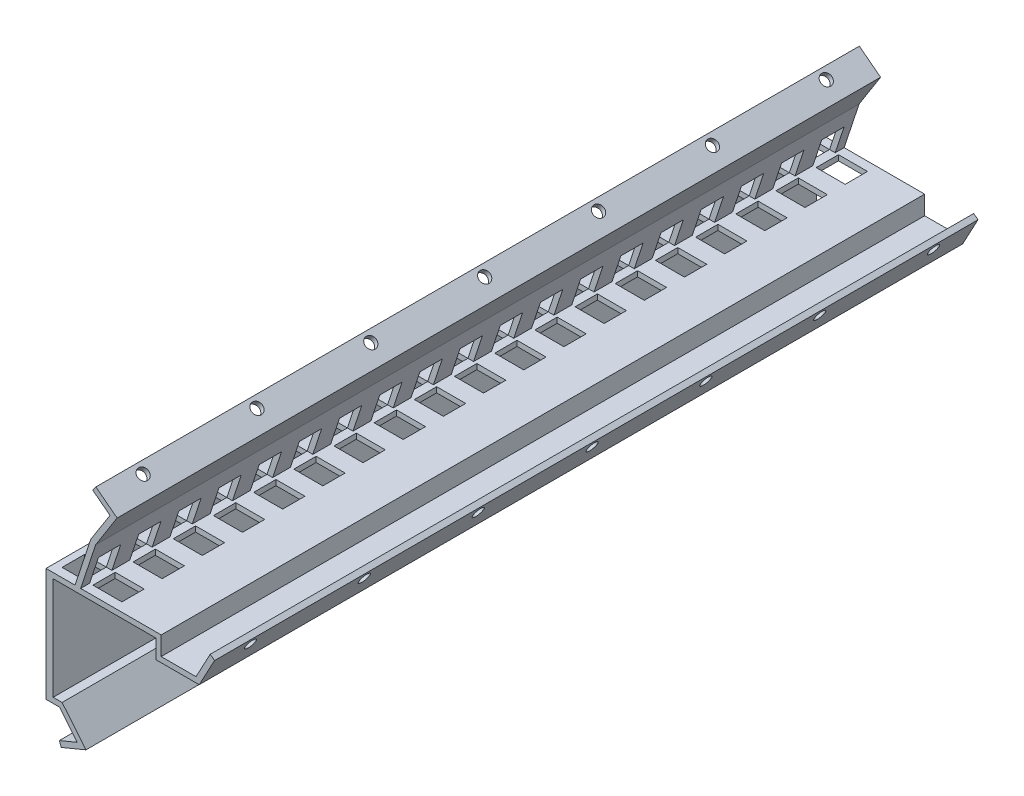
from build123d import *

# Parameters (mm, degrees)
BOSS_EXTRUDE1_DEPTH = 85.5
SKETCH2_W           = 5
SKETCH2_H           = 9
CUT_EXTRUDE1_DEPTH  = 15
LPATTERN2_COUNT     = 19
LPATTERN2_PITCH     = 9
SKETCH3_R           = 1.25
CUT_EXTRUDE2_DEPTH  = 12
SKETCH4_R           = 1.25
CUT_EXTRUDE3_DEPTH  = 12
SKETCH5_R           = 1.25
CUT_EXTRUDE4_DEPTH  = 5
LPATTERN3_COUNT     = 7
LPATTERN3_PITCH     = 25.5
BOSS_EXTRUDE2_START = -169
SKETCH6_W           = 2
SKETCH6_H           = 1.2
SKETCH6_W_2         = 1.6
SKETCH6_H_2         = 3
BOSS_EXTRUDE2_DEPTH = 167


with BuildPart() as part:
    # Sketch1 → Boss-Extrude1 (new, symmetric)
    with BuildSketch(Plane.XY):
        Polygon((0, 0), (2, 0), (7.358048747, -6.520004744), (1.813345586, -8.816695993), (1.389781294, -7.693271427), (5.402946391, -6.030964015), (1.432927702, -1.2), (-1.6, -1.2), (-1.6, 24.2), (4.9, 24.2), (8.423371334, 34.850859927), (12.729886988, 41.653523698), (8.839638939, 44.638616016), (9.570152654, 45.590640024), (14.330272695, 41.93807145), (9.51627051, 34.333771156), (6.163955388, 24.2), (24.2, 24.2), (24.2, 20), (31.997124555, 20), (35.182829163, 25.937342104), (36.147489553, 25.197132153), (32.715082759, 18.8), (23, 18.8), (23, 23), (0, 23), align=None)
    extrude(amount=BOSS_EXTRUDE1_DEPTH, both=True)

    # Sketch2 → Cut-Extrude1 (cut)
    with BuildSketch(Plane.ZY.offset(1.6)):
        with Locations((81, 25.7)):
            Rectangle(SKETCH2_W, SKETCH2_H)
    cut_extrude1 = extrude(amount=-CUT_EXTRUDE1_DEPTH, mode=Mode.SUBTRACT)

    # LPattern2: Cut-Extrude1 ×19
    with Locations(*[(0, 0, -i * LPATTERN2_PITCH) for i in range(1, LPATTERN2_COUNT)]):
        add(cut_extrude1, mode=Mode.SUBTRACT)

    # Sketch3 → Cut-Extrude2 (cut)
    with BuildSketch(Plane(origin=(2.923510956, -7.0579798, 0), x_dir=(0.9238795325112892, 0.3826834323650841, 0), z_dir=(-0.38268343236508406, 0.9238795325112891, 0))):
        with Locations(Location((0.339902976, -76.5, 0), (0, 0, 180))):
            Circle(SKETCH3_R)
    cut_extrude2 = extrude(amount=-CUT_EXTRUDE2_DEPTH, mode=Mode.SUBTRACT)

    # Sketch4 → Cut-Extrude3 (cut)
    with BuildSketch(Plane(origin=(24.834682045, 32.365187767, 0), x_dir=(0.7933533402912303, -0.6087614290087271, 0), z_dir=(-0.6087614290087271, -0.7933533402912303, 0))):
        with Locations((-18.161310596, 76.5)):
            Circle(SKETCH4_R)
    cut_extrude3 = extrude(amount=-CUT_EXTRUDE3_DEPTH, mode=Mode.SUBTRACT)

    # Sketch5 → Cut-Extrude4 (cut)
    with BuildSketch(Plane(origin=(17.569718246, -9.427102465, 0), x_dir=(0, 0, -1), z_dir=(0.8811717857655161, -0.47279623937888016, 0))):
        with Locations(Location((-76.5, 37.293399059, 0), (0, 0, 90))):
            Circle(SKETCH5_R)
    cut_extrude4 = extrude(amount=-CUT_EXTRUDE4_DEPTH, mode=Mode.SUBTRACT)

    # LPattern3: Cut-Extrude2, Cut-Extrude3, Cut-Extrude4 ×7
    with Locations(*[(0, 0, -i * LPATTERN3_PITCH) for i in range(1, LPATTERN3_COUNT)]):
        add(cut_extrude2, mode=Mode.SUBTRACT)
        add(cut_extrude3, mode=Mode.SUBTRACT)
        add(cut_extrude4, mode=Mode.SUBTRACT)

    # Sketch6 → Boss-Extrude2 (add)
    with BuildSketch(Plane.XY.offset(85.5).offset(BOSS_EXTRUDE2_START)):
        with Locations((5.9, 23.6)):
            Rectangle(SKETCH6_W, SKETCH6_H)
        with Locations((-0.8, 22.7)):
            Rectangle(SKETCH6_W_2, SKETCH6_H_2)
    extrude(amount=BOSS_EXTRUDE2_DEPTH)


solid = part.part
